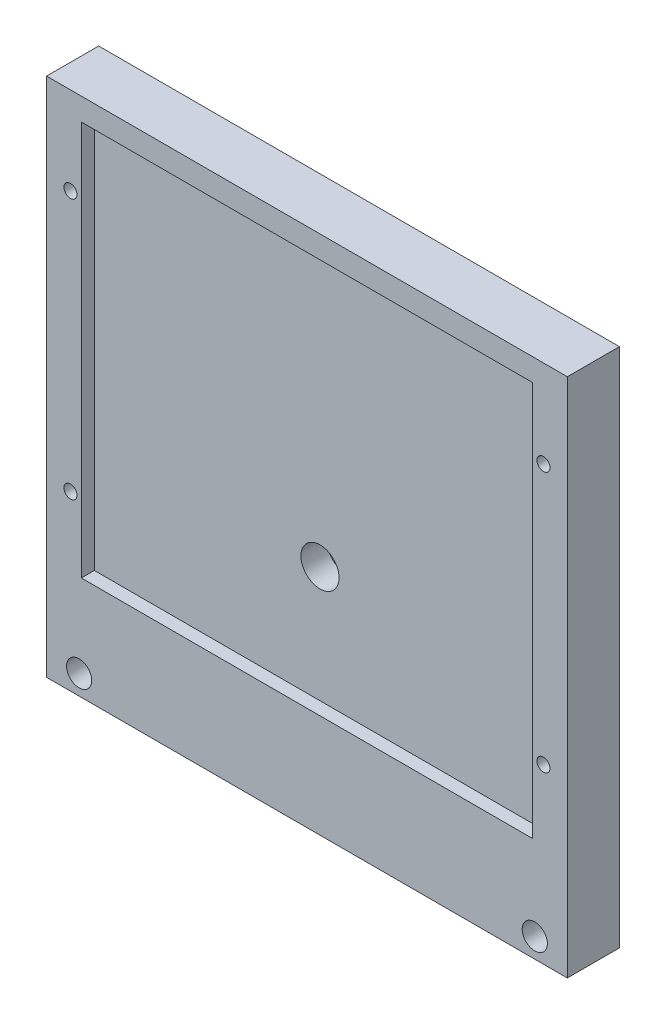
from build123d import *

# Parameters (mm, degrees)
SKETCH_1_W          = 120
SKETCH_1_H          = 120
EXTRUDE_1_DEPTH     = 12
SKETCH_2_W          = 104
SKETCH_2_H          = 91
CUT_EXTRUDE_1_DEPTH = 3
SKETCH_4_R          = 2.25
CUT_EXTRUDE_3_DEPTH = 12
SKETCH_6_R          = 1.75
CUT_EXTRUDE_5_DEPTH = 12
SKETCH_7_R          = 2.9
SKETCH_7_R_2        = 4.4
CUT_EXTRUDE_6_DEPTH = 9
SKETCH_8_R          = 1.5
CUT_EXTRUDE_7_DEPTH = 12


with BuildPart() as part:
    # 草图1 → 凸台-拉伸1 (new body)
    with BuildSketch(Plane.XY):
        with Locations((-10.243902439, 2.026266417)):
            Rectangle(SKETCH_1_W, SKETCH_1_H)
    extrude(amount=EXTRUDE_1_DEPTH)

    # 草图2 → 切除-拉伸1 (cut)
    with BuildSketch(Plane.XY.offset(12)):
        with Locations((-10.243902439, 11.360648518)):
            Rectangle(SKETCH_2_W, SKETCH_2_H)
    extrude(amount=-CUT_EXTRUDE_1_DEPTH, mode=Mode.SUBTRACT)

    # 草图4 → 切除-拉伸3 (cut)
    with BuildSketch(Plane.XY.offset(12)):
        with Locations((-10.243902439, -7.42403473)):
            Circle(SKETCH_4_R)
    extrude(amount=-CUT_EXTRUDE_3_DEPTH, mode=Mode.SUBTRACT)

    # 草图6 → 切除-拉伸5 (cut)
    with BuildSketch(Plane.XY.offset(12)):
        with Locations((-62.743902439, -53.42403473)):
            Circle(SKETCH_6_R)
        with Locations((42.256097561, -53.42403473)):
            Circle(SKETCH_6_R)
    extrude(amount=-CUT_EXTRUDE_5_DEPTH, mode=Mode.SUBTRACT)

    # 草图7 → 切除-拉伸6 (cut)
    with BuildSketch(Plane.XY.offset(12)):
        with Locations((-62.743902439, -53.42403473)):
            Circle(SKETCH_7_R)
        with Locations((42.256097561, -53.42403473)):
            Circle(SKETCH_7_R)
        with Locations((-10.243902439, -7.42403473)):
            Circle(SKETCH_7_R_2)
    extrude(amount=-CUT_EXTRUDE_6_DEPTH, mode=Mode.SUBTRACT)

    # 草图8 → 切除-拉伸7 (cut)
    with BuildSketch(Plane.XY.offset(12)):
        with Locations((-64.743902439, -18.139351482)):
            Circle(SKETCH_8_R)
        with Locations((-64.743902439, 41.860648518)):
            Circle(SKETCH_8_R)
        with Locations((44.256097561, 41.860648518)):
            Circle(SKETCH_8_R)
        with Locations((44.256097561, -18.139351482)):
            Circle(SKETCH_8_R)
    extrude(amount=-CUT_EXTRUDE_7_DEPTH, mode=Mode.SUBTRACT)


solid = part.part
